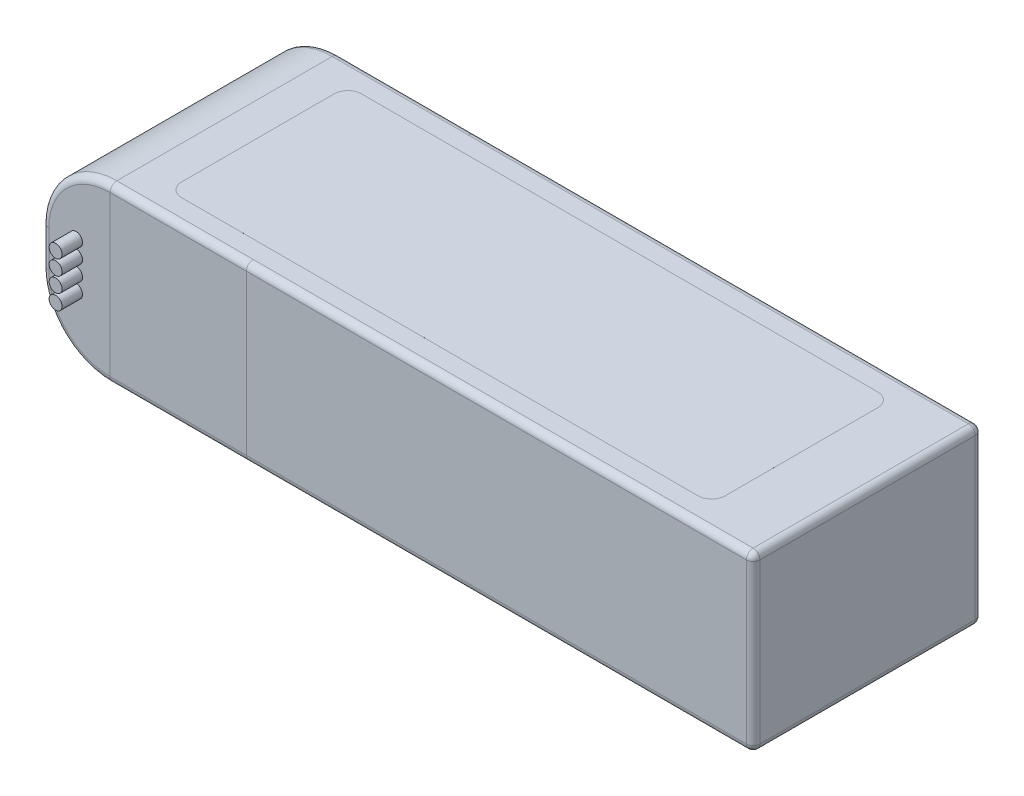
from build123d import *

# Parameters (mm, degrees)
SKETCH1_W           = 104.4
SKETCH1_H           = 33.6
BOSS_EXTRUDE1_DEPTH = 12.7
FILLET1_R           = 10
SKETCH2_R           = 1.9
BOSS_EXTRUDE2_DEPTH = 5
SKETCH4_R           = 0.95
BOSS_EXTRUDE3_DEPTH = 3
SKETCH5_W           = 20
SKETCH5_H           = 25.4
BOSS_EXTRUDE4_DEPTH = 0.0001
BOSS_EXTRUDE5_DEPTH = 0.0001
BOSS_EXTRUDE6_DEPTH = 0.0001
FILLET7_R           = 1
FILLET8_R           = 1


with BuildPart() as part:
    # Sketch1 → Boss-Extrude1 (new, symmetric)
    with BuildSketch(Plane(origin=(0, 0, 0), x_dir=(1, 0, 0), z_dir=(0, 1, 0))):
        Rectangle(SKETCH1_W, SKETCH1_H)
    extrude(amount=BOSS_EXTRUDE1_DEPTH, both=True)

    # Fillet1
    fillet1_edges = [part.edges().sort_by_distance(p)[0] for p in [
        (-52.2, 12.7, 0),
        (-52.2, -12.7, 0),
    ]]
    fillet(fillet1_edges, radius=FILLET1_R)

    # Sketch2 → Boss-Extrude2 (add)
    with BuildSketch(Plane(origin=(0, 0, -16.8), x_dir=(-1, 0, 0), z_dir=(0, 0, -1))):
        with Locations(Location((44.2, 3.35, 0), (0, 0, 180))):
            Circle(SKETCH2_R)
        with Locations(Location((44.2, -3.35, 0), (0, 0, 180))):
            Circle(SKETCH2_R)
    extrude(amount=BOSS_EXTRUDE2_DEPTH)

    # Sketch4 → Boss-Extrude3 (add)
    with BuildSketch(Plane.XY.offset(16.8)):
        with Locations(Location((-47.2, 3.3, 0), (0, 0, 180))):
            Circle(SKETCH4_R)
        with Locations(Location((-47.2, 1.1, 0), (0, 0, 180))):
            Circle(SKETCH4_R)
        with Locations(Location((-47.2, -1.1, 0), (0, 0, 180))):
            Circle(SKETCH4_R)
        with Locations(Location((-47.2, -3.3, 0), (0, 0, 180))):
            Circle(SKETCH4_R)
    extrude(amount=BOSS_EXTRUDE3_DEPTH)

    # Sketch5 → Boss-Extrude4 (add)
    with BuildSketch(Plane.XY.offset(16.8)):
        with Locations((-32.2, 0)):
            Rectangle(SKETCH5_W, SKETCH5_H)
    boss_extrude4 = extrude(amount=BOSS_EXTRUDE4_DEPTH)

    # Mirror1: Boss-Extrude4 across plane
    add(boss_extrude4.mirror(Plane.XY))

    # Mirror1 at the second plane: Boss-Extrude4 across plane
    add(boss_extrude4.mirror(Plane.ZX))

    # Sketch6 → Boss-Extrude5 (add)
    with BuildSketch(Plane(origin=(0, 12.7, 0), x_dir=(1, 0, 0), z_dir=(0, 1, 0))):
        with BuildLine():
            Line((-35.3, 13.2), (40.5, 13.2))
            ThreePointArc((40.5, 13.2), (41.914213562, 12.614213562), (42.5, 11.2))
            Line((42.5, 11.2), (42.5, -11.2))
            ThreePointArc((42.5, -11.2), (41.914213562, -12.614213562), (40.5, -13.2))
            Line((40.5, -13.2), (-35.3, -13.2))
            ThreePointArc((-35.3, -13.2), (-36.714213562, -12.614213562), (-37.3, -11.2))
            Line((-37.3, -11.2), (-37.3, 11.2))
            ThreePointArc((-37.3, 11.2), (-36.714213562, 12.614213562), (-35.3, 13.2))
        make_face()
    extrude(amount=BOSS_EXTRUDE5_DEPTH)

    # Sketch7 → Boss-Extrude6 (add)
    with BuildSketch(Plane.XZ.offset(12.7)):
        with BuildLine():
            Line((-23.4, 12.5), (27.5, 12.5))
            ThreePointArc((27.5, 12.5), (28.914213562, 11.914213562), (29.5, 10.5))
            Line((29.5, 10.5), (29.5, -10.5))
            ThreePointArc((29.5, -10.5), (28.914213562, -11.914213562), (27.5, -12.5))
            Line((27.5, -12.5), (-23.4, -12.5))
            ThreePointArc((-23.4, -12.5), (-24.814213562, -11.914213562), (-25.4, -10.5))
            Line((-25.4, -10.5), (-25.4, 10.5))
            ThreePointArc((-25.4, 10.5), (-24.814213562, 11.914213562), (-23.4, 12.5))
        make_face()
    extrude(amount=BOSS_EXTRUDE6_DEPTH)

    # Fillet7
    fillet7_edges = [part.edges().sort_by_distance(p)[0] for p in [
        (52.2, 12.7, 0),
        (-52.2, 0, 16.8),
        (-52.2, 0, -16.8),
        (15, 12.7, -16.8),
        (-49.271067812, 9.771067812, 16.8),
        (-49.271067812, -9.771067812, 16.8),
        (-49.271067812, 9.771067812, -16.8),
        (-49.271067812, -9.771067812, -16.8),
        (15, -12.7, -16.8),
        (52.2, -12.7, 0),
        (15, -12.7, 16.8),
        (15, 12.7, 16.8),
        (52.2, 0, -16.8),
        (52.2, 0, 16.8),
    ]]
    fillet(fillet7_edges, radius=FILLET7_R)

    # Fillet8
    fillet8_edges = [part.edges().sort_by_distance(p)[0] for p in [
        (-32.2, -12.7, 16.8001),
        (-32.2, 12.7, 16.8001),
        (-32.2, 12.7, -16.8001),
        (-32.2, -12.7, -16.8001),
    ]]
    fillet(fillet8_edges, radius=FILLET8_R)


solid = part.part
